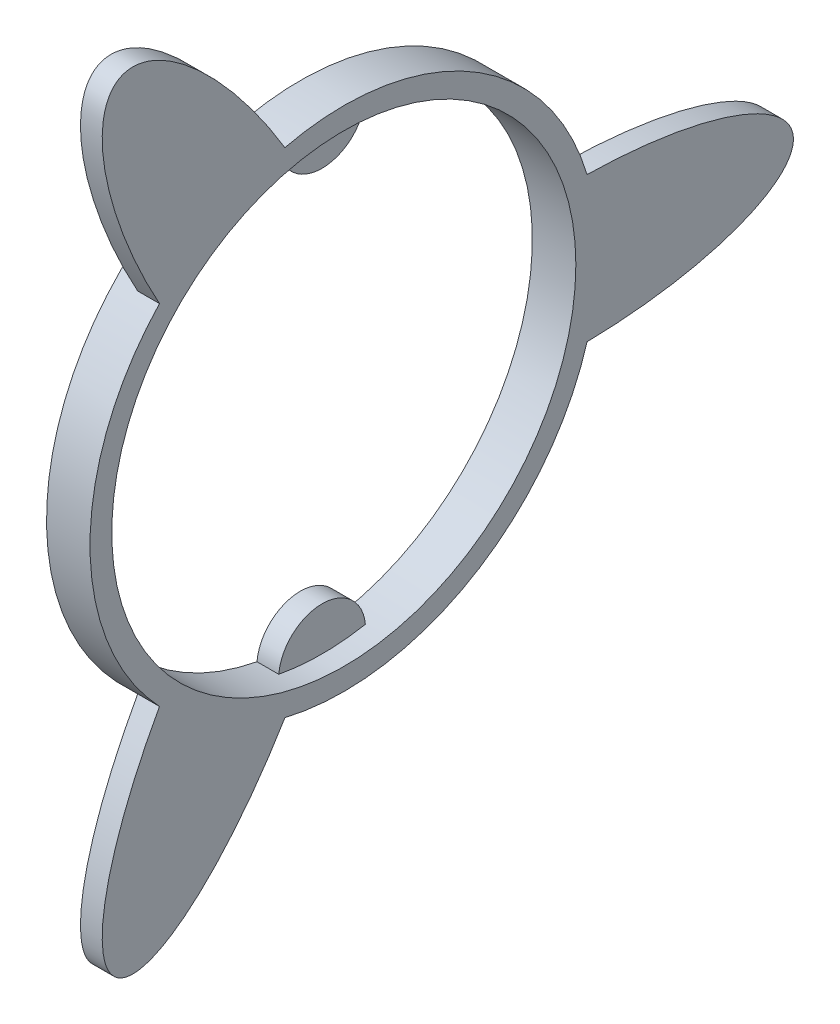
from build123d import *

# Parameters (mm, degrees)
SKETCH1_R           = 17.5
SKETCH1_R_2         = 16
BOSS_EXTRUDE1_DEPTH = 3
BOSS_EXTRUDE2_START = -1.5
BOSS_EXTRUDE2_DEPTH = 1.5
BOSS_EXTRUDE3_DEPTH = 1.5


with BuildPart() as part:
    # Sketch1 → Boss-Extrude1 (new body)
    with BuildSketch(Plane(origin=(0, 0, 0), x_dir=(0, 0, -1), z_dir=(1, 0, 0))):
        Circle(SKETCH1_R)
        Circle(SKETCH1_R_2, mode=Mode.SUBTRACT)
    extrude(amount=BOSS_EXTRUDE1_DEPTH)

    # Sketch2 → Boss-Extrude2 (add)
    with BuildSketch(Plane(origin=(3, 0, 0), x_dir=(0, 0, -1), z_dir=(1, 0, 0)).offset(BOSS_EXTRUDE2_START)):
        with BuildLine():
            ThreePointArc((-12.710624375, 12.028716805), (-8.75, 15.155444566), (-4.061862141, 17.02208201))
            add(Edge.make_bspline(
                [(-4.061862141, 17.02208201), (-11.387413396, 29.2211905), (-15.5, 26.846787517), (-19.612586604, 24.472384534), (-12.710624375, 12.028716805)],
                knots=[1.622318219, 1.622318219, 1.622318219, 3.141592654, 3.141592654, 4.660867088, 4.660867088, 4.660867088], degree=2, weights=[1, 0.725085892, 1, 0.725085892, 1]))
        make_face()
        with BuildLine():
            ThreePointArc((16.772486516, 4.993365204), (17.5, 0), (16.772486516, -4.993365204))
            add(Edge.make_bspline(
                [(16.772486516, -4.993365204), (31, -4.748805966), (31, 0), (31, 4.748805966), (16.772486516, 4.993365204)],
                knots=[1.622318219, 1.622318219, 1.622318219, 3.141592654, 3.141592654, 4.660867088, 4.660867088, 4.660867088], degree=2, weights=[1, 0.725085892, 1, 0.725085892, 1]))
        make_face()
        with BuildLine():
            add(Edge.make_bspline(
                [(-15.5, -26.846787517), (-11.387413396, -29.2211905), (-4.061862141, -17.02208201)],
                knots=[0, 0, 0, 1.519274435, 1.519274435, 1.519274435], degree=2, weights=[1, 0.725085892, 1]))
            ThreePointArc((-4.061862141, -17.02208201), (-8.75, -15.155444566), (-12.710624375, -12.028716805))
            add(Edge.make_bspline(
                [(-12.710624375, -12.028716805), (-19.612586604, -24.472384534), (-15.5, -26.846787517)],
                knots=[4.763910873, 4.763910873, 4.763910873, 6.283185307, 6.283185307, 6.283185307], degree=2, weights=[1, 0.725085892, 1]))
        make_face()
    extrude(amount=BOSS_EXTRUDE2_DEPTH)

    # Sketch3 → Boss-Extrude3 (add)
    with BuildSketch(Plane.ZY):
        with BuildLine():
            Line((3, -16), (-3, -16))
            ThreePointArc((-3, -16), (0, -13), (3, -16))
        make_face()
        with BuildLine():
            Line((3, 16), (-3, 16))
            ThreePointArc((-3, 16), (0, 13), (3, 16))
        make_face()
    extrude(amount=-BOSS_EXTRUDE3_DEPTH)


solid = part.part
